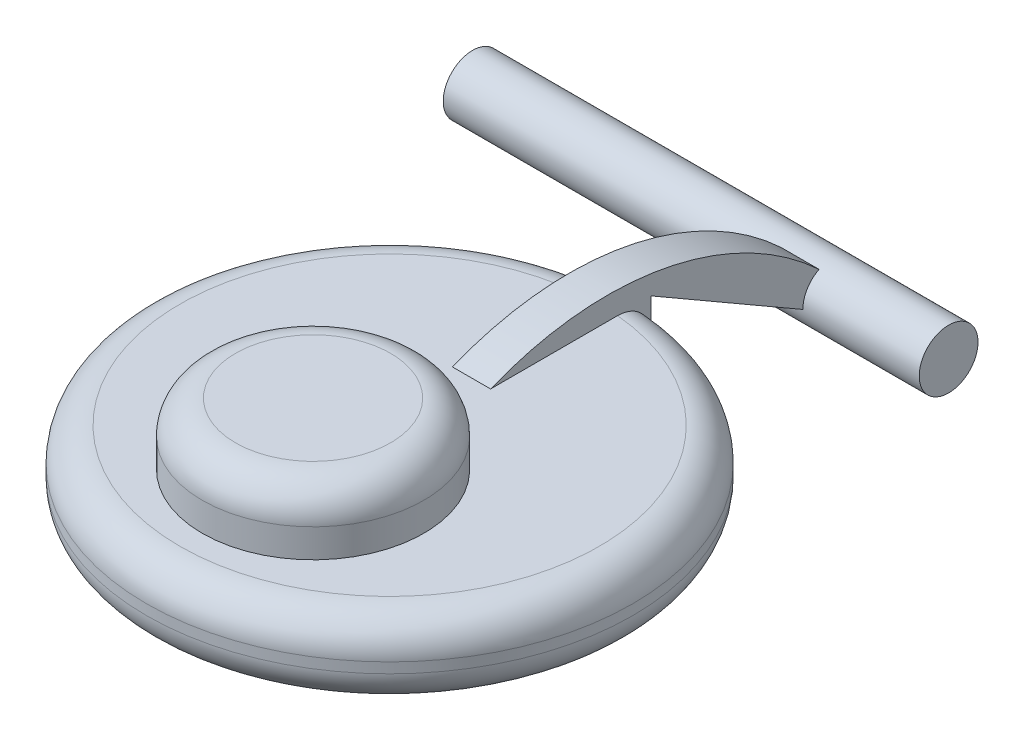
from build123d import *

# Parameters (mm, degrees)
SKETCH1_R           = 2.2479
BOSS_EXTRUDE1_DEPTH = 36.3982
BOSS_EXTRUDE2_DEPTH = 2.921
SKETCH3_R           = 18.5801
BOSS_EXTRUDE3_DEPTH = 5.8674
FILLET1_R           = 2.54
SKETCH4_R           = 8.4709
BOSS_EXTRUDE4_DEPTH = 4.7244
FILLET2_R           = 2.54


with BuildPart() as part:
    # Sketch1 → Boss-Extrude1 (new body)
    with BuildSketch(Plane(origin=(0, 0, 0), x_dir=(0, 0, -1), z_dir=(1, 0, 0))):
        Circle(SKETCH1_R)
    extrude(amount=BOSS_EXTRUDE1_DEPTH)

    # Sketch2 → Boss-Extrude2 (add)
    with BuildSketch(Plane(origin=(27.5082, 0, 0), x_dir=(0, 0, -1), z_dir=(1, 0, 0))):
        with BuildLine():
            Line((0, -1.334463955), (-13.814144421, 6.641136045))
            Line((-13.814144421, 6.641136045), (-26.133144421, 6.641136045))
            ThreePointArc((-26.133144421, 6.641136045), (-12.195347715, 7.850704504), (0, 0.995142749))
            Line((0, 0.995142749), (0, -1.334463955))
        make_face()
    extrude(amount=-BOSS_EXTRUDE2_DEPTH)

    # Sketch3 → Boss-Extrude3 (add)
    with BuildSketch(Plane.XZ.offset(-6.641136045)):
        with Locations(Location((26.0477, 32.394244421, 0), (0, 0, 270))):
            Circle(SKETCH3_R)
    extrude(amount=BOSS_EXTRUDE3_DEPTH)

    # Fillet1
    fillet1_edges = [part.edges().sort_by_distance(p)[0] for p in [
        (26.0477, 6.641136045, 50.974344421),
        (26.0477, 0.773736045, 50.974344421),
    ]]
    fillet(fillet1_edges, radius=FILLET1_R)

    # Sketch4 → Boss-Extrude4 (add)
    with BuildSketch(Plane(origin=(0, 6.641136045, 0), x_dir=(1, 0, 0), z_dir=(0, 1, 0))):
        with Locations(Location((26.0477, -38.248526032, 0), (0, 0, 90))):
            Circle(SKETCH4_R)
    extrude(amount=BOSS_EXTRUDE4_DEPTH)

    # Fillet2
    fillet2_edges = [part.edges().sort_by_distance(p)[0] for p in [
        (26.0477, 11.365536045, 46.719426032),
    ]]
    fillet(fillet2_edges, radius=FILLET2_R)


solid = part.part
